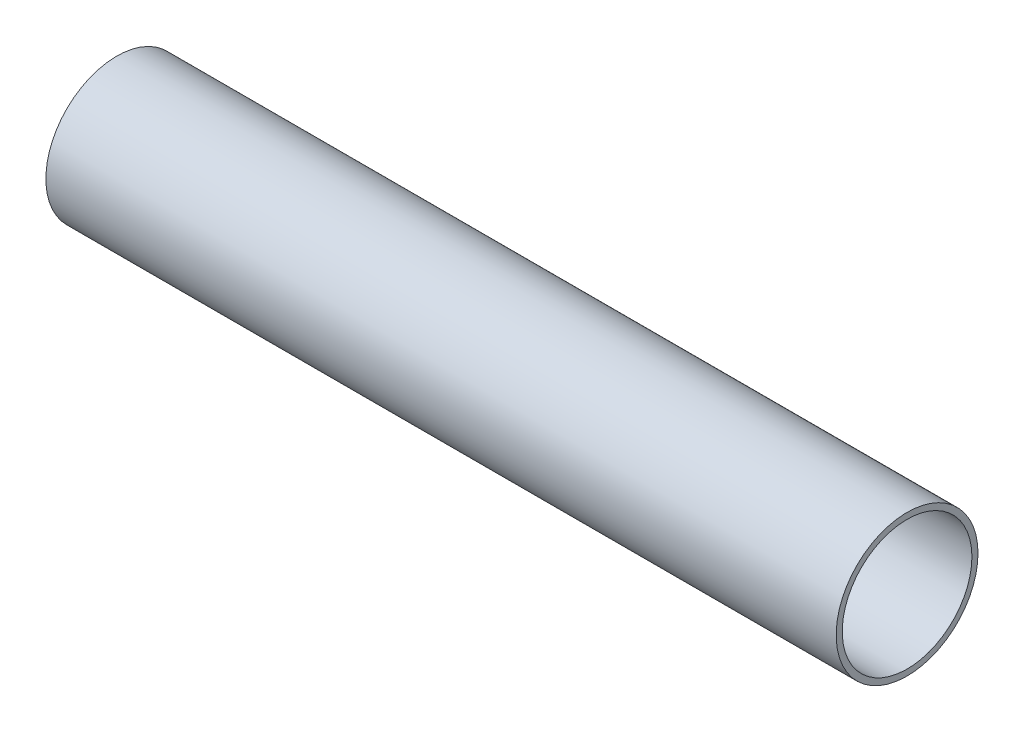
from build123d import *

# Parameters (mm, degrees)
SALIENTE_EXTRUIR1_DEPTH      = 19.5
SALIENTE_EXTRUIR1_DEPTH_BACK = 19.5
CROQUIS3_R                   = 3.5
CROQUIS3_R_2                 = 3.2


with BuildPart() as part:
    # Croquis3 → Saliente-Extruir1 (new, two sides: drawn at the far end of the back side and taken through both)
    with BuildSketch(Plane(origin=(0, 0, 0), x_dir=(0, 0, -1), z_dir=(1, 0, 0)).offset(-SALIENTE_EXTRUIR1_DEPTH_BACK)):
        Circle(CROQUIS3_R)
        Circle(CROQUIS3_R_2, mode=Mode.SUBTRACT)
    extrude(amount=SALIENTE_EXTRUIR1_DEPTH + SALIENTE_EXTRUIR1_DEPTH_BACK)


solid = part.part
